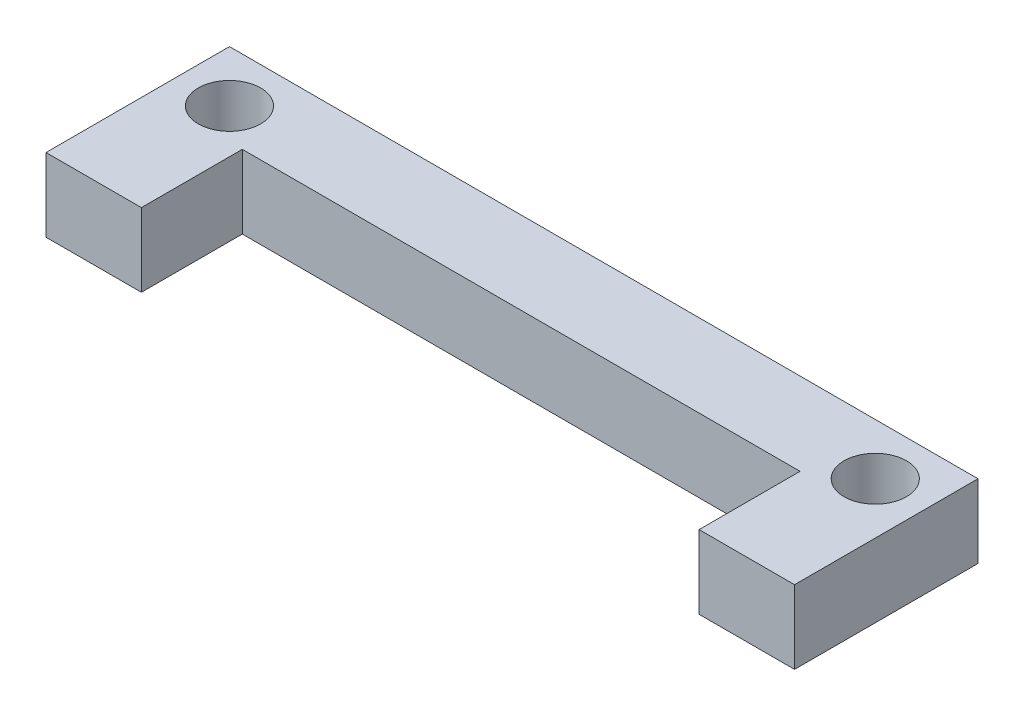
from build123d import *

# Parameters (mm, degrees)
SKETCH1_R           = 4.25
BOSS_EXTRUDE1_DEPTH = 10


with BuildPart() as part:
    # Sketch1 → Boss-Extrude1 (new body)
    with BuildSketch(Plane(origin=(0, 0, 0), x_dir=(1, 0, 0), z_dir=(0, 1, 0))):
        Polygon((-51, 11.25), (51, 11.25), (51, 0), (51, -13.75), (38, -13.75), (38, 0), (-38, 0), (-38, -13.75), (-51, -13.75), align=None)
        with Locations(Location((-44, 4.25, 0), (0, 0, 270))):
            Circle(SKETCH1_R, mode=Mode.SUBTRACT)
        with Locations(Location((44, 4.25, 0), (0, 0, 90))):
            Circle(SKETCH1_R, mode=Mode.SUBTRACT)
    extrude(amount=BOSS_EXTRUDE1_DEPTH)


solid = part.part
